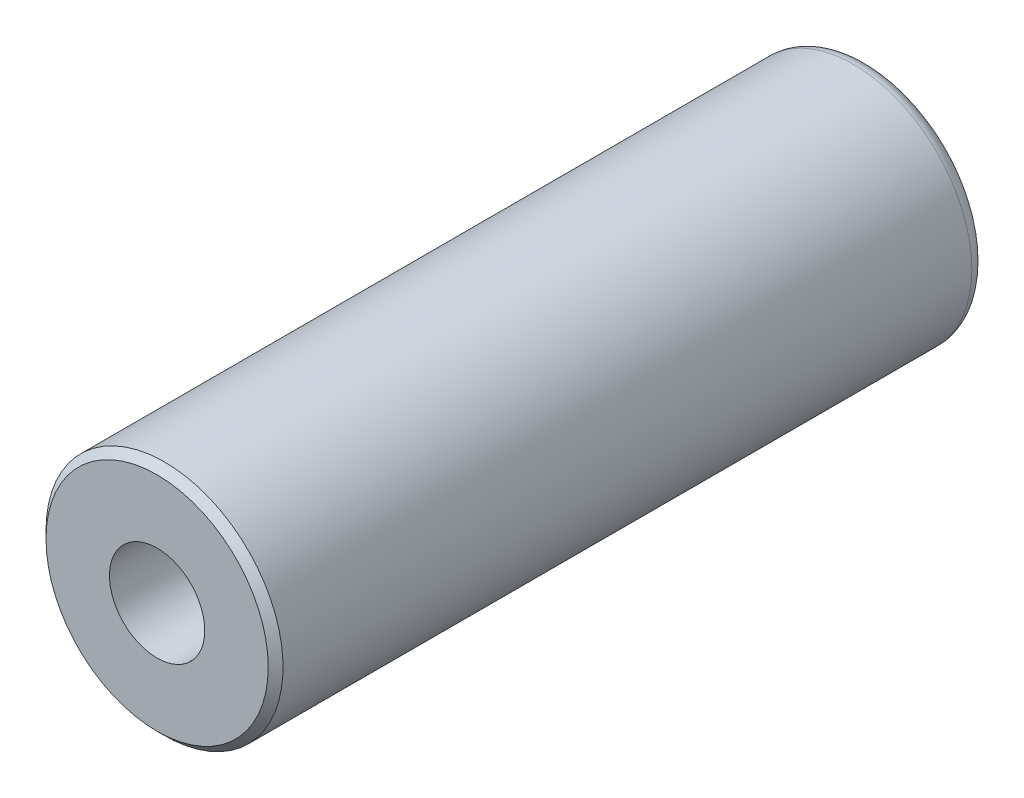
from build123d import *

# Parameters (mm, degrees)
SKETCH1_R                   = 6.35
EXTRUDE1_DEPTH              = 38.1
F_1_4_20_TAPPED_HOLE1_D     = 5.1054
F_1_4_20_TAPPED_HOLE1_DEPTH = 16.51
F_1_4_20_TAPPED_HOLE1_TIP   = 1.533816902
CHAMFER1_SIZE               = 0.396875
FILLET1_R                   = 0.79375


with BuildPart() as part:
    # Sketch1 → Extrude1 (new body)
    with BuildSketch(Plane.XY):
        with Locations(Location((0, 0, 0), (0, 0, 180))):
            Circle(SKETCH1_R)
    extrude(amount=EXTRUDE1_DEPTH)

    # 1/4-20 Tapped Hole1
    with Locations(Plane.XY.offset(38.1)):
        with Locations((0, 0)):
            Hole(F_1_4_20_TAPPED_HOLE1_D / 2, depth=F_1_4_20_TAPPED_HOLE1_DEPTH)
            with Locations((0, 0, -(F_1_4_20_TAPPED_HOLE1_DEPTH + F_1_4_20_TAPPED_HOLE1_TIP / 2))):  # 118° drill point
                Cone(0, F_1_4_20_TAPPED_HOLE1_D / 2, F_1_4_20_TAPPED_HOLE1_TIP, mode=Mode.SUBTRACT)

    # Chamfer1
    chamfer1_edges = [part.edges().sort_by_distance(p)[0] for p in [
        (6.35, 0, 38.1),
    ]]
    chamfer(chamfer1_edges, length=CHAMFER1_SIZE)

    # Fillet1
    fillet1_edges = [part.edges().sort_by_distance(p)[0] for p in [
        (6.35, 0, 0),
    ]]
    fillet(fillet1_edges, radius=FILLET1_R)


solid = part.part
